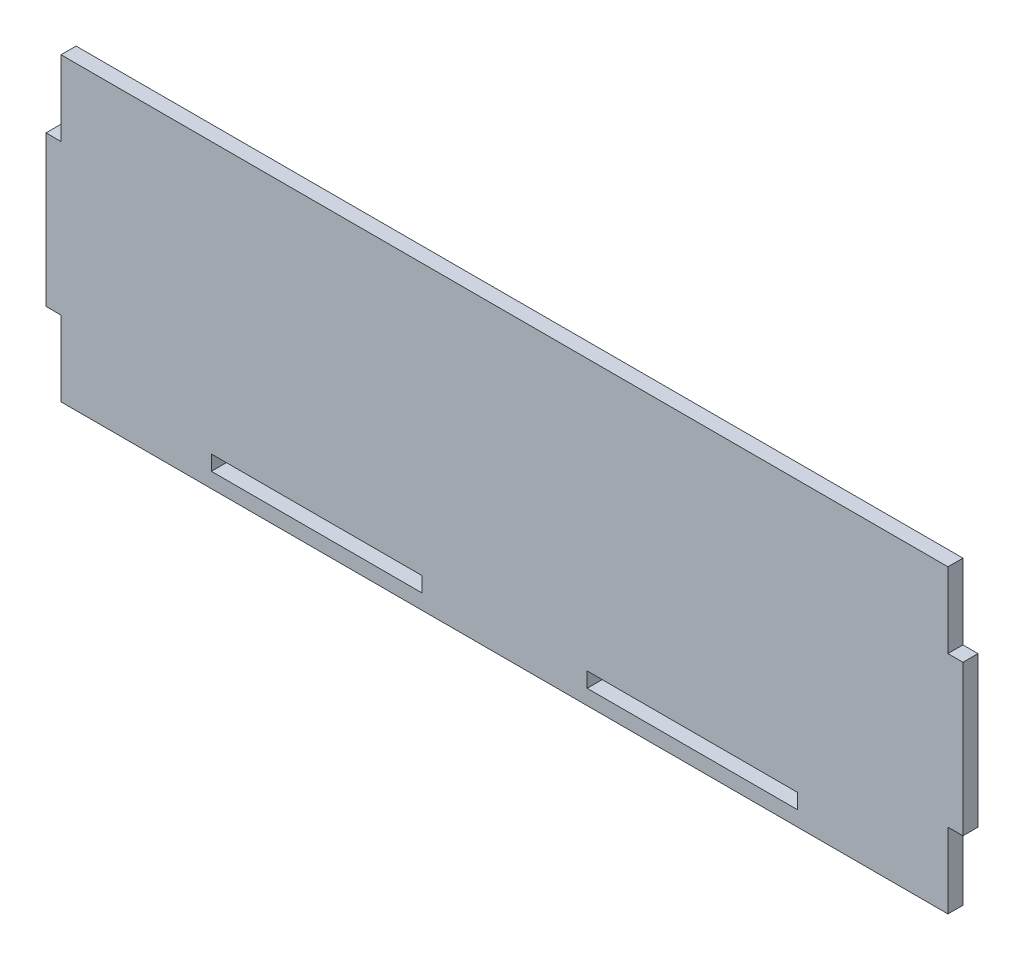
from build123d import *

# Parameters (mm, degrees)
SKETCH1_W           = 295
SKETCH1_H           = 100
SKETCH1_W_2         = 5
SKETCH1_H_2         = 50
BOSS_EXTRUDE1_DEPTH = 5
SKETCH2_W           = 70
SKETCH2_H           = 5
CUT_EXTRUDE1_DEPTH  = 5


with BuildPart() as part:
    # Sketch1 → Boss-Extrude1 (new body)
    with BuildSketch(Plane.XY):
        with Locations((-147.5, 50)):
            Rectangle(SKETCH1_W, SKETCH1_H)
        with Locations((2.5, 50)):
            Rectangle(SKETCH1_W_2, SKETCH1_H_2)
        with Locations((-297.5, 50)):
            Rectangle(SKETCH1_W_2, SKETCH1_H_2)
    extrude(amount=BOSS_EXTRUDE1_DEPTH)

    # Sketch2 → Cut-Extrude1 (cut)
    with BuildSketch(Plane.XY.offset(5)):
        with Locations((-210, 7.5)):
            Rectangle(SKETCH2_W, SKETCH2_H)
        with Locations((-85, 7.5)):
            Rectangle(SKETCH2_W, SKETCH2_H)
    extrude(amount=-CUT_EXTRUDE1_DEPTH, mode=Mode.SUBTRACT)


solid = part.part
